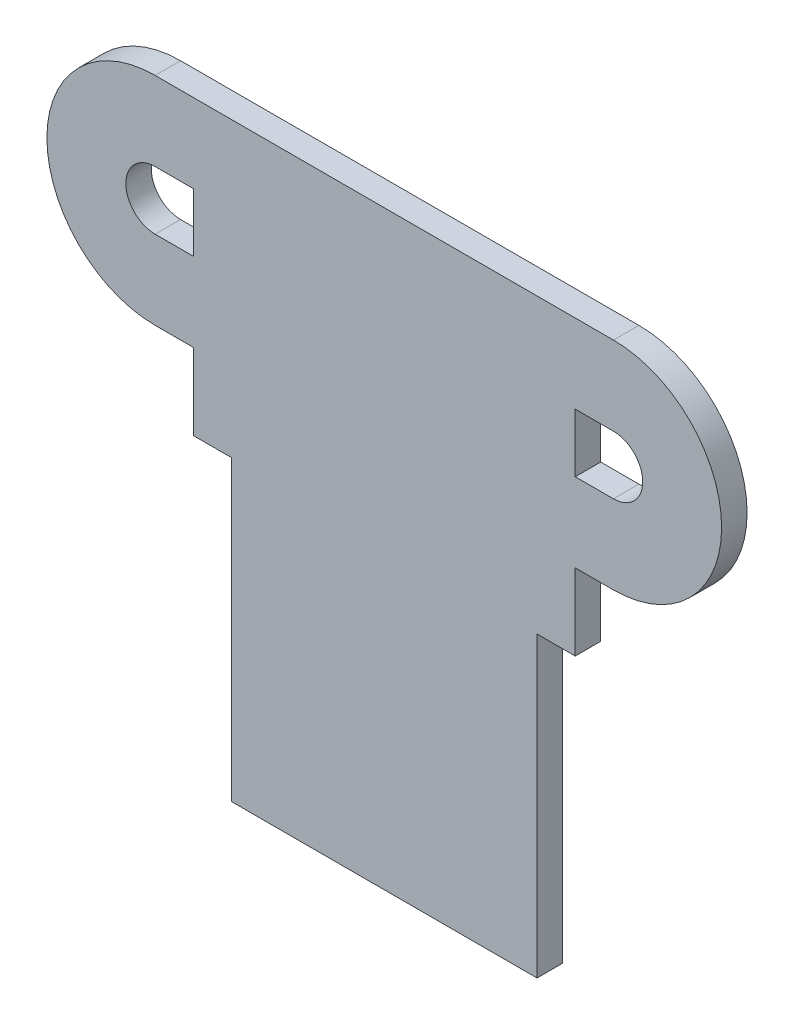
from build123d import *

# Parameters (mm, degrees)
BOSS_EXTRU_1_DEPTH = 1


with BuildPart() as part:
    # Esquisse1 → Boss.-Extru.1 (new body)
    with BuildSketch(Plane.XY):
        with BuildLine():
            Line((12, 11.7), (13.5, 11.7))
            Line((13.5, 11.7), (13.5, 14.7))
            Line((13.5, 14.7), (15, 14.7))
            ThreePointArc((15, 14.7), (19.25, 18.95), (15, 23.2))
            Line((15, 23.2), (-3, 23.2))
            ThreePointArc((-3, 23.2), (-7.25, 18.95), (-3, 14.7))
            Line((-3, 14.7), (-1.5, 14.7))
            Line((-1.5, 14.7), (-1.5, 11.7))
            Line((-1.5, 11.7), (0, 11.7))
            Line((0, 11.7), (0, 0))
            Line((0, 0), (12, 0))
            Line((12, 0), (12, 11.7))
        make_face()
        with BuildLine():
            Line((15, 20.1), (13.5, 20.1))
            Line((13.5, 20.1), (13.5, 17.8))
            Line((13.5, 17.8), (15, 17.8))
            ThreePointArc((15, 17.8), (16.15, 18.95), (15, 20.1))
        make_face(mode=Mode.SUBTRACT)
        with BuildLine():
            Line((-3, 20.1), (-1.5, 20.1))
            Line((-1.5, 20.1), (-1.5, 17.8))
            Line((-1.5, 17.8), (-3, 17.8))
            ThreePointArc((-3, 17.8), (-4.15, 18.95), (-3, 20.1))
        make_face(mode=Mode.SUBTRACT)
    extrude(amount=BOSS_EXTRU_1_DEPTH)


solid = part.part
